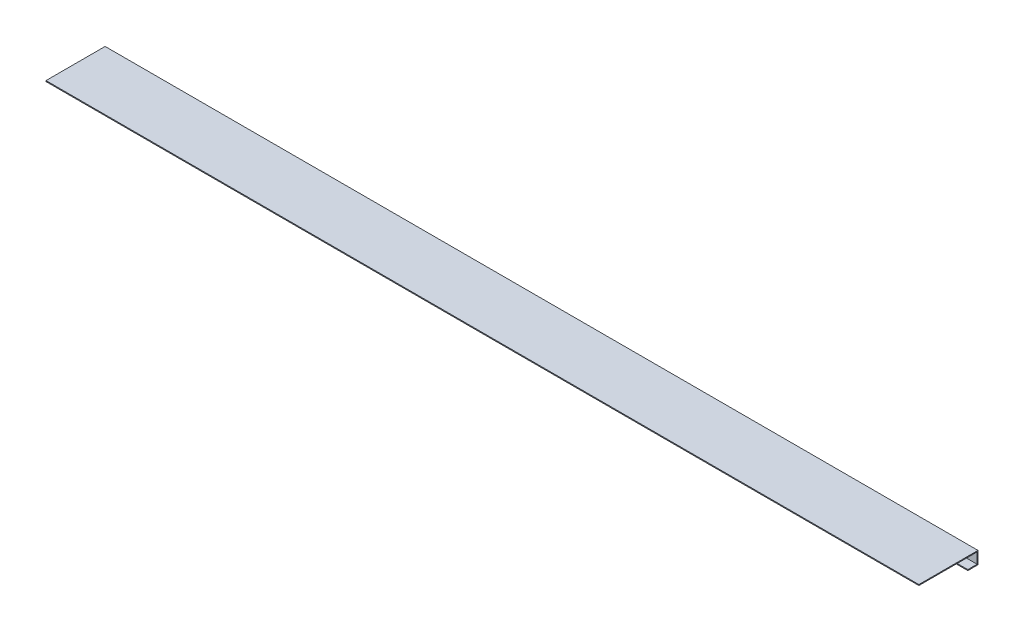
from build123d import *

# Parameters (mm, degrees)
BOSS_EXTRUDE1_DEPTH = 1890


with BuildPart() as part:
    # Sketch1 → Boss-Extrude1 (new body)
    with BuildSketch(Plane(origin=(0, 0, 0), x_dir=(0, 0, -1), z_dir=(1, 0, 0))):
        Polygon((0, 0), (128, 0), (128, -27), (106, -27), (106, -25), (126, -25), (126, -2), (0, -2), align=None)
    extrude(amount=BOSS_EXTRUDE1_DEPTH)


solid = part.part
